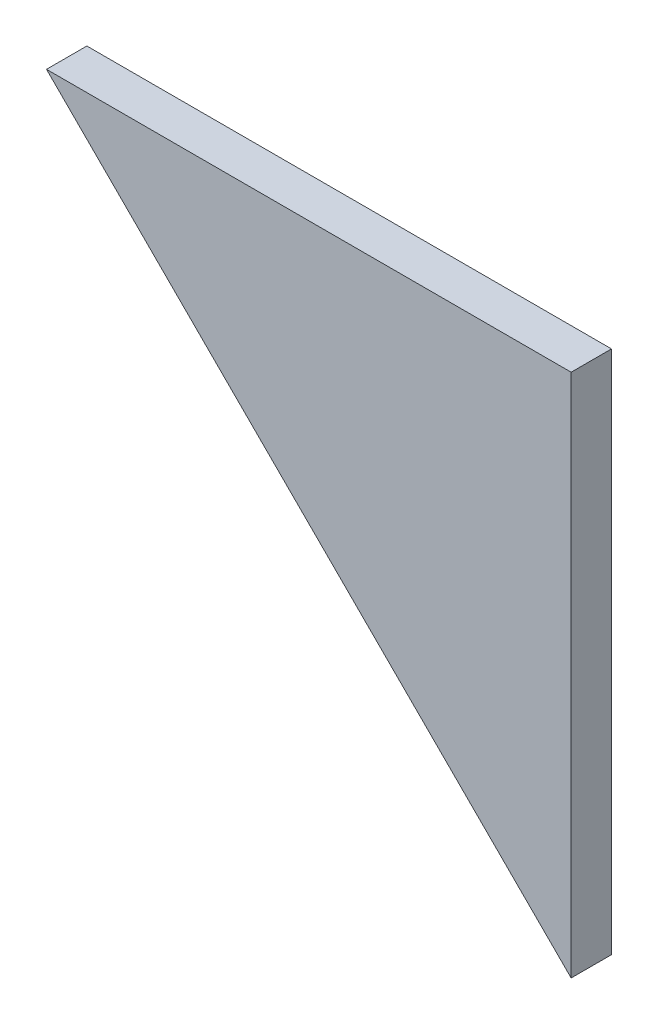
from build123d import *

# Parameters (mm, degrees)
BOSS_EXTRUDE1_DEPTH = 2


with BuildPart() as part:
    # Sketch1 → Boss-Extrude1 (new body)
    with BuildSketch(Plane.XY):
        Polygon((965, -169.5), (939, -143.5), (965, -143.5), align=None)
    extrude(amount=-BOSS_EXTRUDE1_DEPTH)


solid = part.part
